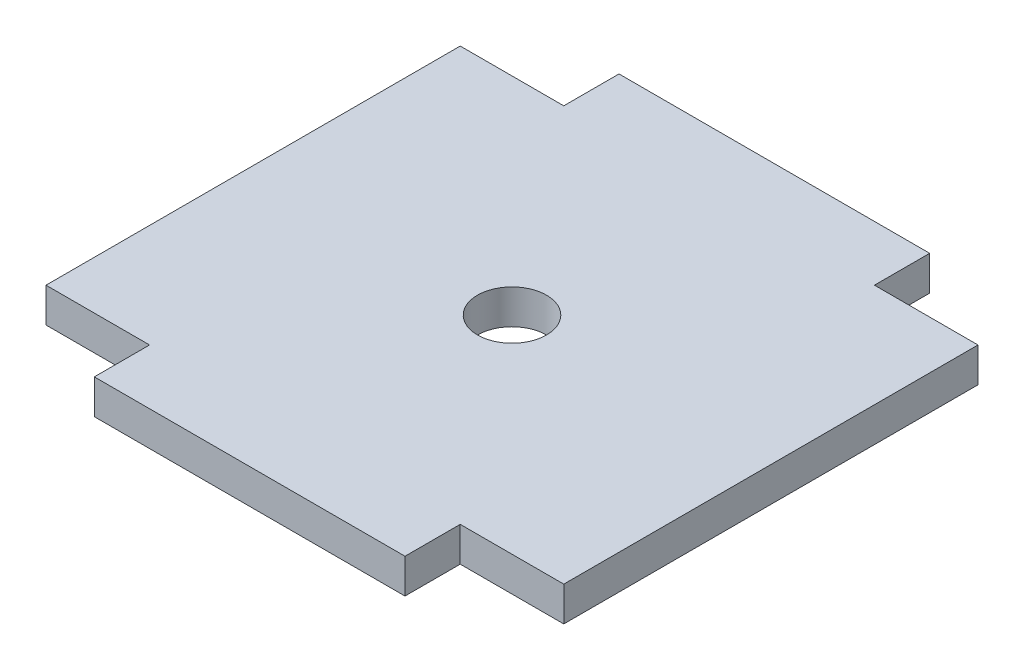
from build123d import *

# Parameters (mm, degrees)
SCHIZZO1_W                   = 75
SCHIZZO1_H                   = 60
ESTRUSIONE_ESTRUSIONE1_DEPTH = 5
SCHIZZO2_R                   = 5
TAGLIO_ESTRUSIONE1_DEPTH     = 49.28301979
SCHIZZO3_W                   = 45
SCHIZZO3_H                   = 5
ESTRUSIONE_ESTRUSIONE2_DEPTH = 8


with BuildPart() as part:
    # Schizzo1 → Estrusione-Estrusione1 (new body)
    with BuildSketch(Plane(origin=(0, 0, 0), x_dir=(1, 0, 0), z_dir=(0, 1, 0))):
        Rectangle(SCHIZZO1_W, SCHIZZO1_H)
    extrude(amount=ESTRUSIONE_ESTRUSIONE1_DEPTH)

    # Schizzo2 → Taglio-Estrusione1 (cut, through all)
    with BuildSketch(Plane(origin=(0, 5, 0), x_dir=(-1, 0, 0), z_dir=(0, 1, 0))):
        with Locations(Location((0, 0, 0), (0, 0, 90))):
            Circle(SCHIZZO2_R)
    extrude(amount=-TAGLIO_ESTRUSIONE1_DEPTH, mode=Mode.SUBTRACT)

    # Schizzo3 → Estrusione-Estrusione2 (add)
    with BuildSketch(Plane.XY.offset(30)):
        with Locations((0, 2.5)):
            Rectangle(SCHIZZO3_W, SCHIZZO3_H)
    estrusione_estrusione2 = extrude(amount=ESTRUSIONE_ESTRUSIONE2_DEPTH)

    # Specchia1: Estrusione-Estrusione2 across plane
    add(estrusione_estrusione2.mirror(Plane.XY))


solid = part.part
